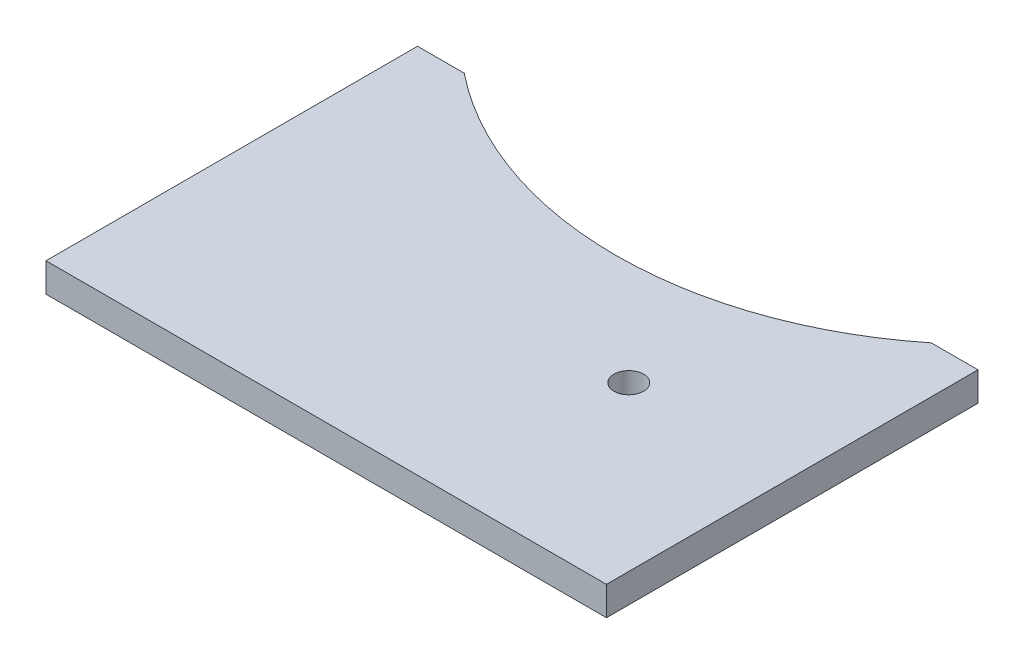
from build123d import *

# Parameters (mm, degrees)
SALIENTE_EXTRUIR1_DEPTH = 6.2
CROQUIS2_R              = 3.175
CORTAR_EXTRUIR1_DEPTH   = 145.106369341


with BuildPart() as part:
    # Croquis1 → Saliente-Extruir1 (new body)
    with BuildSketch(Plane(origin=(0, 0, 0), x_dir=(1, 0, 0), z_dir=(0, 1, 0))):
        with BuildLine():
            Line((0, 0), (0, -79.550020016))
            Line((0, -79.550020016), (120, -79.550020016))
            Line((120, -79.550020016), (120, 0))
            Line((120, 0), (110, 0))
            ThreePointArc((110, 0), (60, -17.550020016), (10, 0))
            Line((10, 0), (0, 0))
        make_face()
    extrude(amount=SALIENTE_EXTRUIR1_DEPTH)

    # Croquis2 → Cortar-Extruir1 (cut, through all)
    with BuildSketch(Plane(origin=(0, 6.2, 0), x_dir=(1, 0, 0), z_dir=(0, 1, 0))):
        with Locations(Location((85, -39.775010008, 0), (0, 0, 270))):
            Circle(CROQUIS2_R)
    extrude(amount=-CORTAR_EXTRUIR1_DEPTH, mode=Mode.SUBTRACT)


solid = part.part
